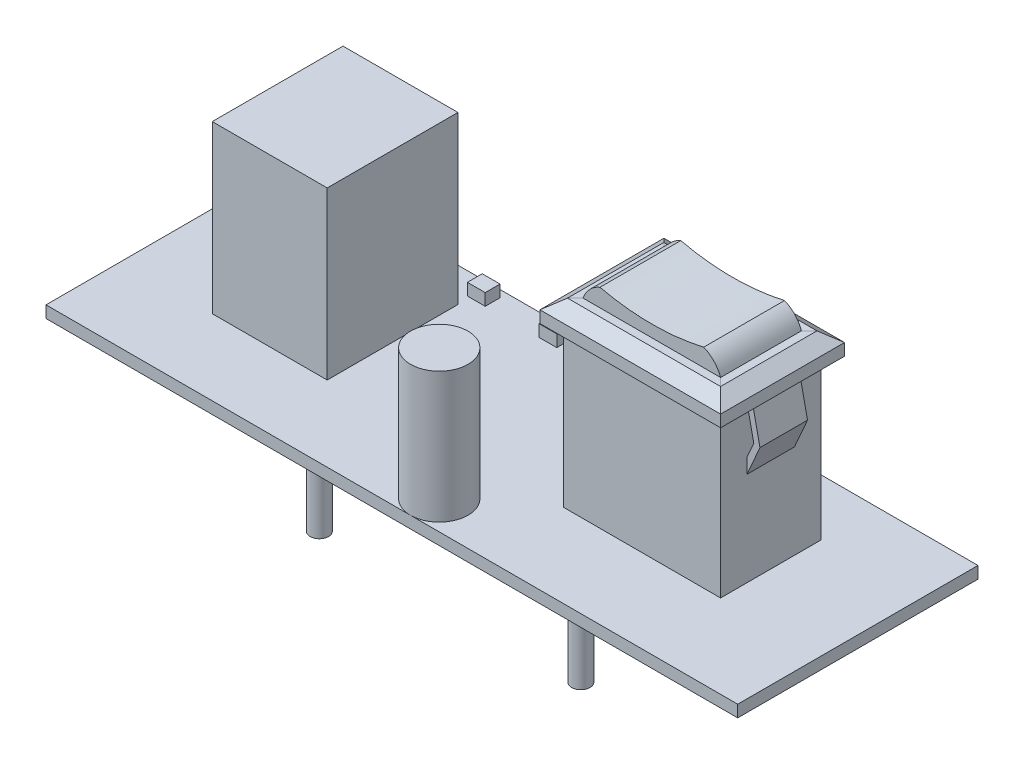
from build123d import *

# Parameters (mm, degrees)
SKETCH1_W                = 58.2
SKETCH1_H                = 20.22
BOSS_EXTRUDE1_DEPTH      = 1
BOSS_EXTRUDE2_DEPTH      = 14
BOSS_EXTRUDE2_DEPTH_BACK = 5.2
SKETCH2_W                = 9.67
SKETCH2_H                = 11
SKETCH3_R                = 2.42
BOSS_EXTRUDE3_DEPTH      = 11
BOSS_EXTRUDE4_DEPTH      = 13.4
BOSS_EXTRUDE4_DEPTH_BACK = 4.3
SKETCH4_W                = 13.2
SKETCH4_H                = 8.43
SKETCH7_W                = 11.57
SKETCH7_H                = 6.8
BOSS_EXTRUDE5_DEPTH      = 3.35
CUT_EXTRUDE1_DEPTH       = 38.095225097
CUT_EXTRUDE1_DEPTH_BACK  = 38.095225097
EXTRUDE_THIN2_DEPTH      = 2
SKETCH10_R               = 0.775
BOSS_EXTRUDE6_DEPTH      = 8
SKETCH12_W               = 1.5
SKETCH12_H               = 1.25
BOSS_EXTRUDE7_DEPTH      = 1


with BuildPart() as part:
    # Sketch1 → Boss-Extrude1 (new body)
    with BuildSketch(Plane(origin=(0, 0, 0), x_dir=(1, 0, 0), z_dir=(0, 1, 0))):
        Rectangle(SKETCH1_W, SKETCH1_H)
    extrude(amount=BOSS_EXTRUDE1_DEPTH)

    # Sketch2 → Boss-Extrude2 (add, two sides: drawn at the far end of the back side and taken through both)
    with BuildSketch(Plane(origin=(0, 1, 0), x_dir=(1, 0, 0), z_dir=(0, 1, 0)).offset(-BOSS_EXTRUDE2_DEPTH_BACK)):
        with Locations((-16.625, 1.74)):
            Rectangle(SKETCH2_W, SKETCH2_H)
    extrude(amount=BOSS_EXTRUDE2_DEPTH + BOSS_EXTRUDE2_DEPTH_BACK)

    # Sketch3 → Boss-Extrude3 (add)
    with BuildSketch(Plane(origin=(0, 1, 0), x_dir=(1, 0, 0), z_dir=(0, 1, 0))):
        with Locations(Location((1.57, -7.69, 0), (0, 0, 270))):
            Circle(SKETCH3_R)
    extrude(amount=BOSS_EXTRUDE3_DEPTH)

    # Sketch4 → Boss-Extrude4 (add, two sides: drawn at the far end of the back side and taken through both)
    with BuildSketch(Plane(origin=(0, 1, 0), x_dir=(1, 0, 0), z_dir=(0, 1, 0)).offset(-BOSS_EXTRUDE4_DEPTH_BACK)):
        with Locations((14.04, 1.125)):
            Rectangle(SKETCH4_W, SKETCH4_H)
    extrude(amount=BOSS_EXTRUDE4_DEPTH + BOSS_EXTRUDE4_DEPTH_BACK)

    # Sweep1: sweep along a path in Sketch6
    with BuildLine(Plane(origin=(0, 14.4, 0), x_dir=(1, 0, 0), z_dir=(0, 1, 0))) as sweep1_path:
        Line((7.44, 5.34), (7.44, -3.09))
        Line((7.44, -3.09), (20.64, -3.09))
        Line((20.64, -3.09), (20.64, 5.34))
        Line((20.64, 5.34), (7.44, 5.34))
    # Sketch5 → Sweep1 (sweep)
    with BuildSketch(Plane.ZY.offset(-7.44)):
        Polygon((3.09, 14.4), (4.09, 14.4), (4.09, 15.4), (2.93, 16.25), (2.275, 16.25), (2.275, 14.4), align=None)
    sweep(path=sweep1_path.line, transition=Transition.RIGHT)

    # Sketch7 → Boss-Extrude5 (add)
    with BuildSketch(Plane(origin=(0, 14.4, 0), x_dir=(1, 0, 0), z_dir=(0, 1, 0))):
        with Locations((14.04, 1.125)):
            Rectangle(SKETCH7_W, SKETCH7_H)
    extrude(amount=BOSS_EXTRUDE5_DEPTH)

    # Sketch8 → Cut-Extrude1 (cut, two sides: drawn at the far end of the back side and taken through both)
    with BuildSketch(Plane(origin=(0, 0, -4.525), x_dir=(-1, 0, 0), z_dir=(0, 0, -1)).offset(-CUT_EXTRUDE1_DEPTH_BACK)):
        with BuildLine():
            ThreePointArc((-19.825, 16.25), (-19.277156121, 17.153507794), (-18.405, 17.75))
            Line((-18.405, 17.75), (-19.825, 17.75))
            Line((-19.825, 17.75), (-19.825, 16.25))
        make_face()
        with BuildLine():
            ThreePointArc((-18.405, 17.75), (-16.236771779, 17.375407367), (-14.04, 17.25))
            Line((-14.04, 17.25), (-14.04, 17.75))
            Line((-14.04, 17.75), (-18.405, 17.75))
        make_face()
        with BuildLine():
            Line((-14.04, 17.75), (-14.04, 17.25))
            ThreePointArc((-14.04, 17.25), (-11.843228221, 17.375407367), (-9.675, 17.75))
            Line((-9.675, 17.75), (-14.04, 17.75))
        make_face()
        with BuildLine():
            Line((-8.255, 17.75), (-9.675, 17.75))
            ThreePointArc((-9.675, 17.75), (-8.802843879, 17.153507794), (-8.255, 16.25))
            Line((-8.255, 16.25), (-8.255, 17.75))
        make_face()
    extrude(amount=CUT_EXTRUDE1_DEPTH + CUT_EXTRUDE1_DEPTH_BACK, mode=Mode.SUBTRACT)

    # Sketch9 → Extrude-Thin2 (add, symmetric)
    with BuildSketch(Plane(origin=(0, 0, -1.125), x_dir=(-1, 0, 0), z_dir=(0, 0, -1))):
        Polygon((-20.988853725, 14.920998164), (-21.1, 14.4), (-21.74, 11.4), (-19.788926462, 6.965741958), (-19.331268945, 7.167111265), (-21.217317359, 11.453584933), (-20.611003582, 14.295680764), (-20.499857307, 14.816678928), align=None)
    extrude_thin2 = extrude(amount=EXTRUDE_THIN2_DEPTH, both=True)

    # Mirror1: Extrude-Thin2 across plane
    add(extrude_thin2.mirror(Plane(origin=(14.04, 0, 0), x_dir=(0, 0, 1), z_dir=(1, 0, 0))))

    # Sketch10 → Boss-Extrude6 (add)
    with BuildSketch(Plane.XZ):
        with Locations(Location((-10.1, 6.11, 0), (0, 0, 270))):
            Circle(SKETCH10_R)
        with Locations(Location((11.9, 6.11, 0), (0, 0, 270))):
            Circle(SKETCH10_R)
    extrude(amount=BOSS_EXTRUDE6_DEPTH)

    # Sketch12 → Boss-Extrude7 (add)
    with BuildSketch(Plane(origin=(0, 1, 0), x_dir=(1, 0, 0), z_dir=(0, 1, 0))):
        with Locations((-17.29, 8.885)):
            Rectangle(SKETCH12_W, SKETCH12_H)
        with Locations((-11.265, 8.885)):
            Rectangle(SKETCH12_W, SKETCH12_H)
        with Locations((-5.24, 8.885)):
            Rectangle(SKETCH12_W, SKETCH12_H)
        with Locations((0.785, 8.885)):
            Rectangle(SKETCH12_W, SKETCH12_H)
        with Locations((6.81, 8.885)):
            Rectangle(SKETCH12_W, SKETCH12_H)
    extrude(amount=BOSS_EXTRUDE7_DEPTH)


solid = part.part
